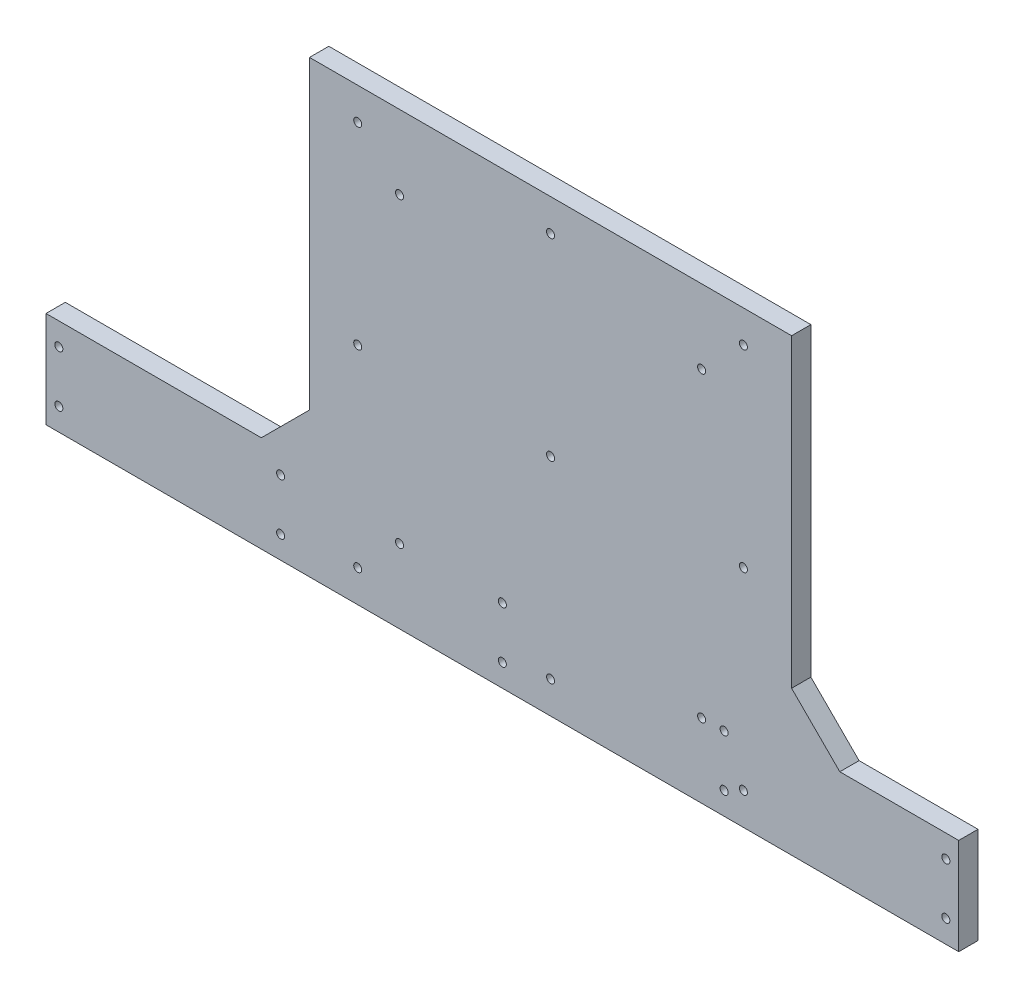
from build123d import *

# Parameters (mm, degrees)
ESQUISSE1_W             = 150
ESQUISSE1_H             = 140
BOSS_EXTRU_1_DEPTH      = 6
ESQUISSE2_R             = 1.25
ENL_V_MAT_EXTRU_1_DEPTH = 206.270553173
ESQUISSE3_R             = 1.25
ENL_V_MAT_EXTRU_2_DEPTH = 206.270553173
ESQUISSE4_W             = 82
ESQUISSE4_H             = 30
ESQUISSE4_W_2           = 52
BOSS_EXTRU_2_DEPTH      = 6
ESQUISSE5_R             = 1.25
ENL_V_MAT_EXTRU_3_DEPTH = 246.845479926
CHANFREIN1_SIZE         = 15


with BuildPart() as part:
    # Esquisse1 → Boss.-Extru.1 (new body)
    with BuildSketch(Plane.XY):
        with Locations((75, 70)):
            Rectangle(ESQUISSE1_W, ESQUISSE1_H)
    extrude(amount=BOSS_EXTRU_1_DEPTH)

    # Esquisse2 → Enlèv. mat.-Extru.1 (cut, through all)
    with BuildSketch(Plane.XY.offset(6)):
        with Locations((28, 117)):
            Circle(ESQUISSE2_R)
        with Locations(Location((122, 117, 0), (0, 0, 180))):
            Circle(ESQUISSE2_R)
        with Locations((122, 23)):
            Circle(ESQUISSE2_R)
        with Locations(Location((28, 23, 0), (0, 0, 180))):
            Circle(ESQUISSE2_R)
    extrude(amount=-ENL_V_MAT_EXTRU_1_DEPTH, mode=Mode.SUBTRACT)

    # Esquisse3 → Enlèv. mat.-Extru.2 (cut, through all)
    with BuildSketch(Plane.XY.offset(6)):
        with Locations((75, 10)):
            Circle(ESQUISSE3_R)
        with Locations((15, 10)):
            Circle(ESQUISSE3_R)
        with Locations(Location((135, 10, 0), (0, 0, 180))):
            Circle(ESQUISSE3_R)
        with Locations((135, 70)):
            Circle(ESQUISSE3_R)
        with Locations(Location((15, 70, 0), (0, 0, 180))):
            Circle(ESQUISSE3_R)
        with Locations(Location((75, 70, 0), (0, 0, 180))):
            Circle(ESQUISSE3_R)
        with Locations((135, 130)):
            Circle(ESQUISSE3_R)
        with Locations(Location((15, 130, 0), (0, 0, 180))):
            Circle(ESQUISSE3_R)
        with Locations(Location((75, 130, 0), (0, 0, 180))):
            Circle(ESQUISSE3_R)
    extrude(amount=-ENL_V_MAT_EXTRU_2_DEPTH, mode=Mode.SUBTRACT)

    # Esquisse4 → Boss.-Extru.2 (add)
    with BuildSketch(Plane.XY.offset(6)):
        with Locations((-41, 15)):
            Rectangle(ESQUISSE4_W, ESQUISSE4_H)
        with Locations((176, 15)):
            Rectangle(ESQUISSE4_W_2, ESQUISSE4_H)
    extrude(amount=-BOSS_EXTRU_2_DEPTH)

    # Esquisse5 → Enlèv. mat.-Extru.3 (cut, through all)
    with BuildSketch(Plane.XY.offset(6)):
        with Locations((-78, 23)):
            Circle(ESQUISSE5_R)
        with Locations(Location((-78, 7, 0), (0, 0, 180))):
            Circle(ESQUISSE5_R)
        with Locations((198, 7)):
            Circle(ESQUISSE5_R)
        with Locations(Location((198, 23, 0), (0, 0, 180))):
            Circle(ESQUISSE5_R)
        with Locations((60, 7)):
            Circle(ESQUISSE5_R)
        with Locations(Location((60, 23, 0), (0, 0, 180))):
            Circle(ESQUISSE5_R)
        with Locations((-9, 23)):
            Circle(ESQUISSE5_R)
        with Locations(Location((-9, 7, 0), (0, 0, 180))):
            Circle(ESQUISSE5_R)
        with Locations((129, 7)):
            Circle(ESQUISSE5_R)
        with Locations(Location((129, 23, 0), (0, 0, 180))):
            Circle(ESQUISSE5_R)
    extrude(amount=-ENL_V_MAT_EXTRU_3_DEPTH, mode=Mode.SUBTRACT)

    # Chanfrein1
    chanfrein1_edges = [part.edges().sort_by_distance(p)[0] for p in [
        (0, 30, 3),
        (150, 30, 3),
    ]]
    chamfer(chanfrein1_edges, length=CHANFREIN1_SIZE)


solid = part.part
